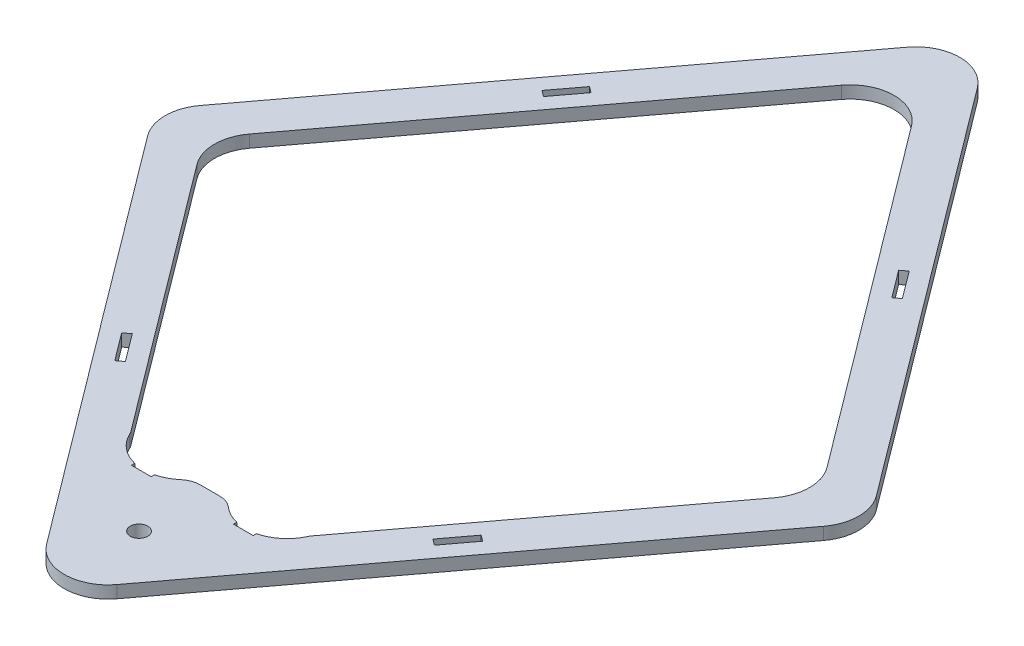
from build123d import *

# Parameters (mm, degrees)
SKETCH1_R           = 4
BOSS_EXTRUDE1_DEPTH = 5.63
FILLET1_R           = 20
FILLET2_R           = 20
FILLET3_R           = 10


with BuildPart() as part:
    # Sketch1 → Boss-Extrude1 (new body)
    with BuildSketch(Plane(origin=(0, 0, 0), x_dir=(1, 0, 0), z_dir=(0, 1, 0))):
        Polygon((-73.819651424, -202.975693425), (89.274098576, 14.482639908), (-73.819651424, 231.940973242), (-236.913401424, 14.482639908), align=None)
        with Locations(Location((-73.819651424, -155.517360092, 0), (0, 0, 270))):
            Circle(SKETCH1_R, mode=Mode.SUBTRACT)
        with BuildLine():
            Line((-214.413401424, 14.482639908), (-114.584807136, -118.622152475))
            ThreePointArc((-114.584807136, -118.622152475), (-109.396341366, -125.717430875), (-101.569651424, -129.718190449))
            Line((-101.569651424, -129.718190449), (-101.569651424, -131.218190449))
            Line((-101.569651424, -131.218190449), (-92.569651424, -131.218190449))
            Line((-92.569651424, -131.218190449), (-92.569651424, -129.718190449))
            ThreePointArc((-92.569651424, -129.718190449), (-86.926275258, -127.32463745), (-82.338731561, -123.258775507))
            Line((-82.338731561, -123.258775507), (-65.300571287, -123.258775507))
            ThreePointArc((-65.300571287, -123.258775507), (-60.71302759, -127.32463745), (-55.069651424, -129.718190449))
            Line((-55.069651424, -129.718190449), (-55.069651424, -131.218190449))
            Line((-55.069651424, -131.218190449), (-46.069651424, -131.218190449))
            Line((-46.069651424, -131.218190449), (-46.069651424, -129.718190449))
            ThreePointArc((-46.069651424, -129.718190449), (-38.242961482, -125.717430875), (-33.054495712, -118.622152475))
            Line((-33.054495712, -118.622152475), (66.774098576, 14.482639908))
            Line((66.774098576, 14.482639908), (-73.819651424, 201.940973242))
            Line((-73.819651424, 201.940973242), (-214.413401424, 14.482639908))
        make_face(mode=Mode.SUBTRACT)
        Polygon((-156.089651424, -81.157360092), (-153.329651424, -79.087360092), (-143.909651424, -91.647360092), (-146.669651424, -93.717360092), align=None, mode=Mode.SUBTRACT)
        Polygon((8.450348576, -81.157360092), (5.690348576, -79.087360092), (-3.729651424, -91.647360092), (-0.969651424, -93.717360092), align=None, mode=Mode.SUBTRACT)
        Polygon((-146.669651424, 122.682639908), (-155.969651424, 110.282639908), (-153.209651424, 108.212639908), (-143.909651424, 120.612639908), align=None, mode=Mode.SUBTRACT)
        Polygon((-0.969651424, 122.682639908), (8.330348576, 110.282639908), (5.570348576, 108.212639908), (-3.729651424, 120.612639908), align=None, mode=Mode.SUBTRACT)
    extrude(amount=BOSS_EXTRUDE1_DEPTH)

    # Fillet1
    fillet1_edges = [part.edges().sort_by_distance(p)[0] for p in [
        (89.274098576, 2.815, -14.482639908),
        (-73.819651424, 2.815, 202.975693425),
        (-236.913401424, 2.815, -14.482639908),
        (-73.819651424, 2.815, -231.940973242),
    ]]
    fillet(fillet1_edges, radius=FILLET1_R)

    # Fillet2
    fillet2_edges = [part.edges().sort_by_distance(p)[0] for p in [
        (66.774098576, 2.815, -14.482639908),
        (-73.819651424, 2.815, -201.940973242),
        (-214.413401424, 2.815, -14.482639908),
    ]]
    fillet(fillet2_edges, radius=FILLET2_R)

    # Fillet3
    fillet3_edges = [part.edges().sort_by_distance(p)[0] for p in [
        (-114.584807136, 2.815, 118.622152475),
        (-82.338731561, 2.815, 123.258775507),
        (-65.300571287, 2.815, 123.258775507),
        (-33.054495712, 2.815, 118.622152475),
    ]]
    fillet(fillet3_edges, radius=FILLET3_R)


solid = part.part
